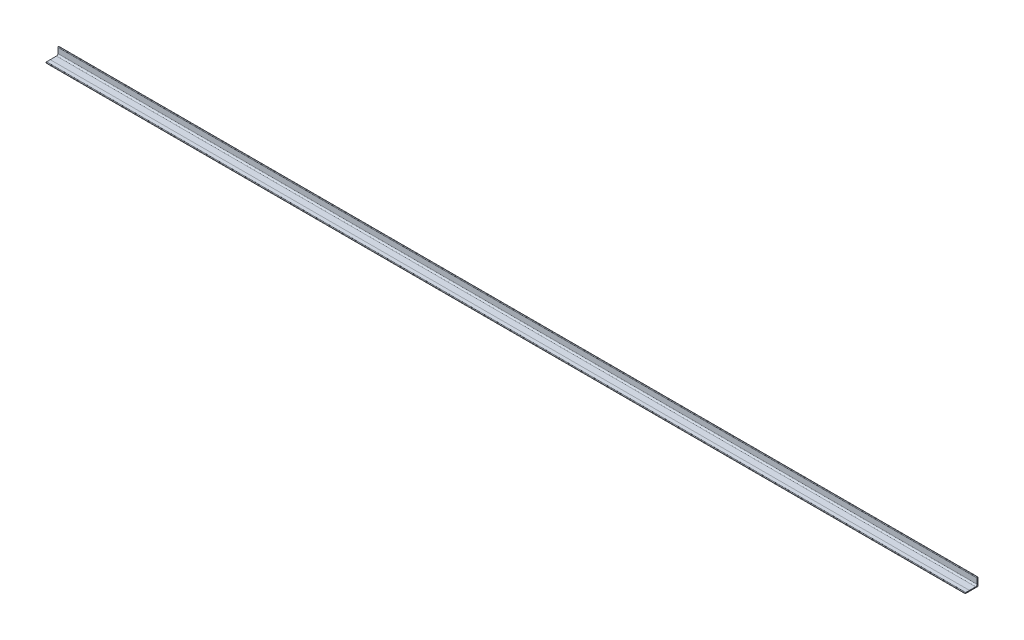
from build123d import *

# Parameters (mm, degrees)
ANGLE_IRON_70X45X4_5_1_DEPTH = 5060
SKETCH12_W                   = 5060
SKETCH12_H                   = 20
BOSS_EXTRUDE1_DEPTH          = 0.1


with BuildPart() as part:
    # Sketch11 → Angle iron 70X45X4.5(1) (new body)
    with BuildSketch(Plane.YZ):
        with BuildLine():
            Line((0, 0), (0, 70))
            Line((0, 70), (1.5, 70))
            ThreePointArc((1.5, 70), (3.621320344, 69.121320344), (4.5, 67))
            Line((4.5, 67), (4.5, 12.5))
            ThreePointArc((4.5, 12.5), (6.843145751, 6.843145751), (12.5, 4.5))
            Line((12.5, 4.5), (42, 4.5))
            ThreePointArc((42, 4.5), (44.121320344, 3.621320344), (45, 1.5))
            Line((45, 1.5), (45, 0))
            Line((45, 0), (0, 0))
        make_face()
    extrude(amount=ANGLE_IRON_70X45X4_5_1_DEPTH)


with BuildPart() as body_2:
    # Sketch12 → Boss-Extrude1 (new body)
    with BuildSketch(Plane(origin=(0, 4.5, 0), x_dir=(1, 0, 0), z_dir=(0, 1, 0))):
        with Locations((2530, -57)):
            Rectangle(SKETCH12_W, SKETCH12_H)
    extrude(amount=BOSS_EXTRUDE1_DEPTH)


solid = Compound([part.part, body_2.part])
